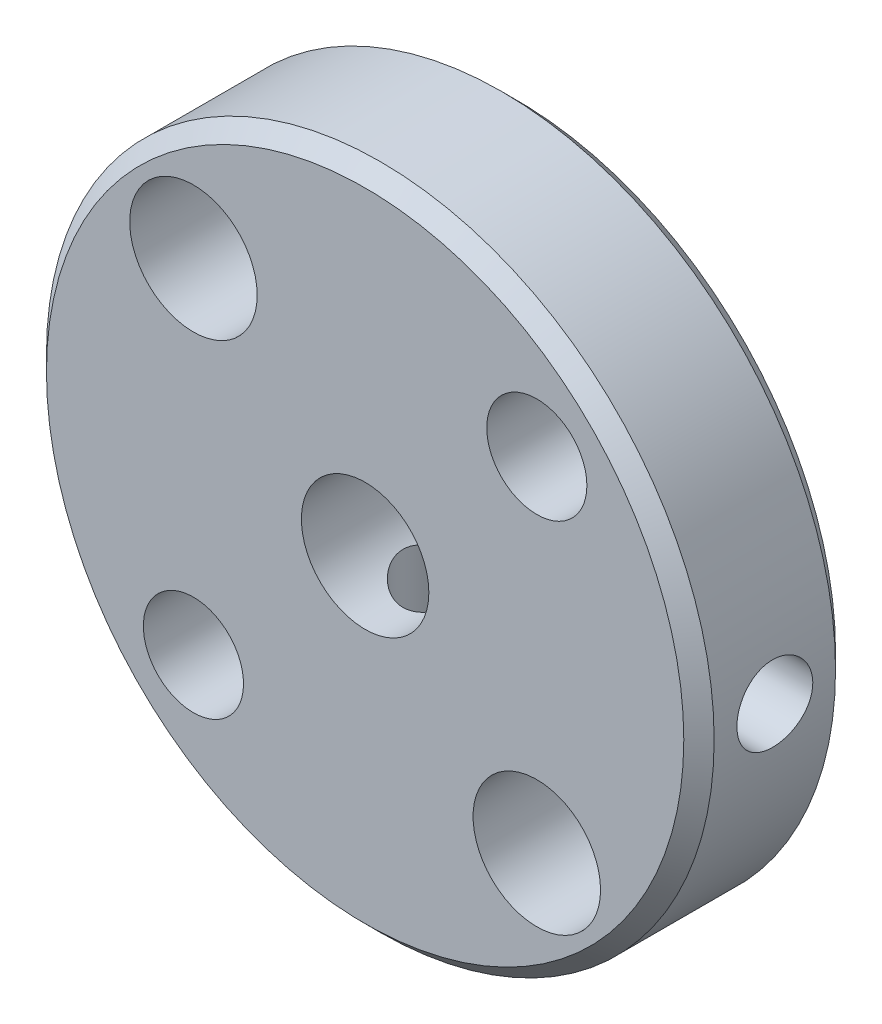
from build123d import *

# Parameters (mm, degrees)
ESQUISSE1_R                  = 4
BOSS_EXTRU_1_DEPTH           = 4
ESQUISSE2_R                  = 11
BOSS_EXTRU_2_DEPTH           = 5
ESQUISSE3_R                  = 2.1
ENL_V_MAT_EXTRU_1_DEPTH      = 18.972200756
TROU_TARAUD_M41_D            = 3.3
ESQUISSE6_R                  = 1.25
ENL_V_MAT_EXTRU_2_DEPTH      = 18.972200756
R_P_TITION_CIRCULAIRE1_COUNT = 2
R_P_TITION_CIRCULAIRE1_ANGLE = 90
CHANFREIN1_SIZE              = 0.5


with BuildPart() as part:
    # Esquisse1 → Boss.-Extru.1 (new body)
    with BuildSketch(Plane.XY):
        Circle(ESQUISSE1_R)
    extrude(amount=BOSS_EXTRU_1_DEPTH)

    # Esquisse2 → Boss.-Extru.2 (add)
    with BuildSketch(Plane.XY.offset(4)):
        Circle(ESQUISSE2_R)
    extrude(amount=BOSS_EXTRU_2_DEPTH)

    # Esquisse3 → Enlèv. mat.-Extru.1 (cut, through all)
    with BuildSketch(Plane.XY.offset(9)):
        with Locations((-5.656854249, 5.656854249)):
            Circle(ESQUISSE3_R)
        with Locations((5.656854249, -5.656854249)):
            Circle(ESQUISSE3_R)
        Circle(ESQUISSE3_R)
    extrude(amount=-ENL_V_MAT_EXTRU_1_DEPTH, mode=Mode.SUBTRACT)

    # Trou taraudé M41 (through all)
    with Locations(Plane.XY.offset(9)):
        with Locations((5.656854249, 5.656854249), (-5.656854249, -5.656854249)):
            Hole(TROU_TARAUD_M41_D / 2)

    # Esquisse6 → Enlèv. mat.-Extru.2 (cut, through all)
    with BuildSketch(Plane(origin=(0, 0, 0), x_dir=(1, 0, 0), z_dir=(0, 1, 0))):
        with Locations(Location((0, -6.5, 0), (0, 0, 270))):
            Circle(ESQUISSE6_R)
    enl_v_mat_extru_2 = extrude(amount=-ENL_V_MAT_EXTRU_2_DEPTH, mode=Mode.SUBTRACT)

    # Répétition circulaire1: Enlèv. mat.-Extru.2 ×2 about axis
    r_p_tition_circulaire1_axis = Axis((0, 0, 9), (0, 0, 1))
    for i in range(1, R_P_TITION_CIRCULAIRE1_COUNT):
        add(enl_v_mat_extru_2.rotate(r_p_tition_circulaire1_axis, i * R_P_TITION_CIRCULAIRE1_ANGLE / (R_P_TITION_CIRCULAIRE1_COUNT - 1)), mode=Mode.SUBTRACT)

    # Chanfrein1
    chanfrein1_edges = [part.edges().sort_by_distance(p)[0] for p in [
        (-4, 0, 0),
        (-11, 0, 4),
        (-11, 0, 9),
    ]]
    chamfer(chanfrein1_edges, length=CHANFREIN1_SIZE)


solid = part.part
